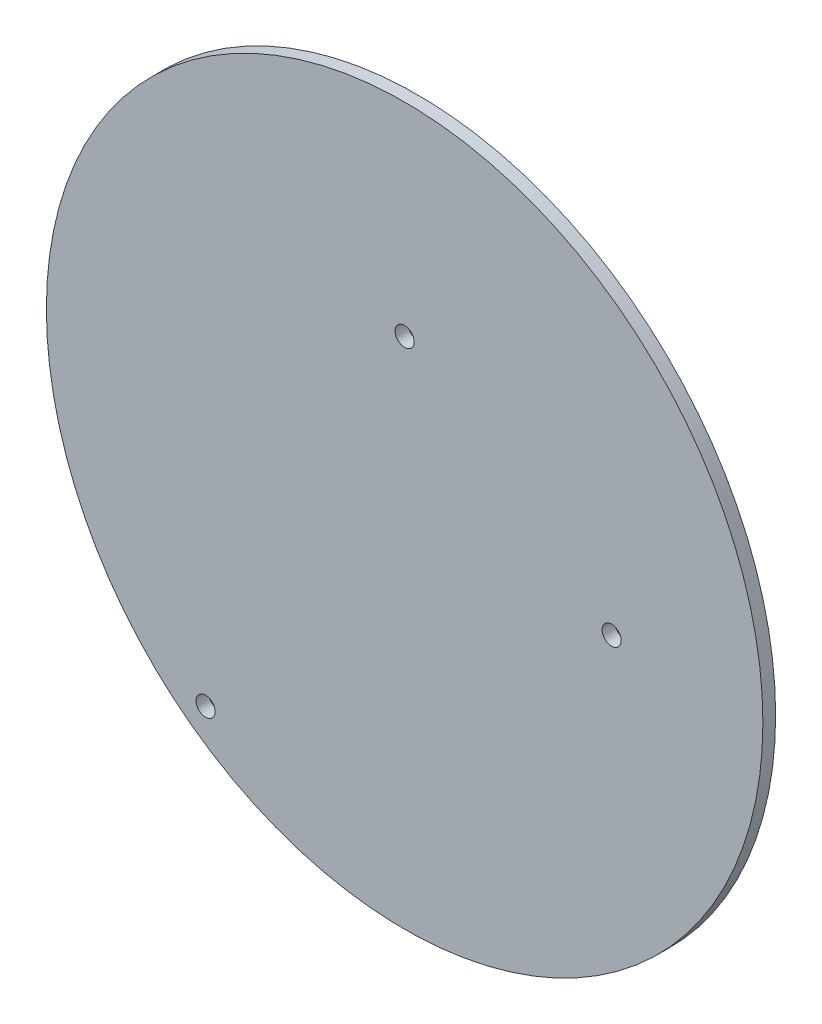
from build123d import *

# Parameters (mm, degrees)
SKETCH5_R                = 45
BOSS_EXTRUDE2_DEPTH      = 1.6
M2_CLEARANCE_HOLE2_D     = 2.4
M2_CLEARANCE_HOLE2_DEPTH = 1.6
M2_CLEARANCE_HOLE2_TIP   = 0.721032743


with BuildPart() as part:
    # Sketch5 → Boss-Extrude2 (new body)
    with BuildSketch(Plane(origin=(0, 0, 0), x_dir=(0, 1, 0), z_dir=(0, 0, 1))):
        with Locations(Location((0, 0, 0), (0, 0, 270))):
            Circle(SKETCH5_R)
    extrude(amount=BOSS_EXTRUDE2_DEPTH)

    # M2 Clearance Hole2
    with Locations(Plane.YX):
        with Locations((-33.221475067, -25), (-42, 26), (0, 26), (19.5, 0)):
            Hole(M2_CLEARANCE_HOLE2_D / 2, depth=M2_CLEARANCE_HOLE2_DEPTH)
            with Locations((0, 0, -(M2_CLEARANCE_HOLE2_DEPTH + M2_CLEARANCE_HOLE2_TIP / 2))):  # 118° drill point
                Cone(0, M2_CLEARANCE_HOLE2_D / 2, M2_CLEARANCE_HOLE2_TIP, mode=Mode.SUBTRACT)


solid = part.part
